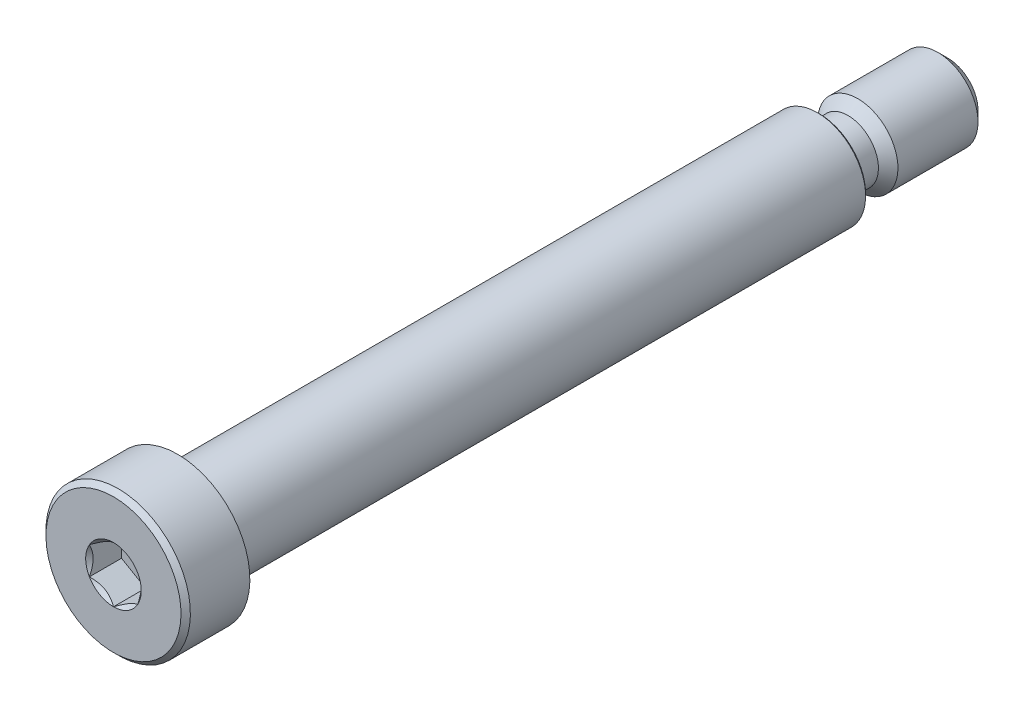
from build123d import *

# Parameters (mm, degrees)
CHAMFER1_SIZE      = 0.993775
CHAMFER2_SIZE      = 0.46434375
CHAMFER3_SIZE      = 0.2032
CUT_EXTRUDE2_DEPTH = 3.175


with BuildPart() as part:
    # Sketch1 → Revolve1 (revolve)
    with BuildSketch(Plane(origin=(0, 0, 0), x_dir=(0, 0, -1), z_dir=(1, 0, 0))):
        Polygon((0, 7.14375), (6.35, 7.14375), (6.35, 4.7625), (69.85, 4.7625), (69.85, 3.9751), (82.55, 3.9751), (82.55, 0), (0, 0), align=None)
    revolve(axis=Axis((0, 0, -82.55), (0, 0, 1)))

    # Sketch5 → Cut-Revolve1 (revolve, cut)
    with BuildSketch(Plane(origin=(0, 0, 0), x_dir=(0, 0, -1), z_dir=(1, 0, 0))):
        with BuildLine():
            Line((69.85, 4.7625), (74.422, 4.7625))
            Line((74.422, 4.7625), (72.6694, 3.0099))
            Line((72.6694, 3.0099), (70.8152, 3.0099))
            ThreePointArc((70.8152, 3.0099), (70.132700535, 3.292600535), (69.85, 3.9751))
            Line((69.85, 3.9751), (69.85, 4.7625))
        make_face()
    revolve(axis=Axis((0, 0, -82.55), (0, 0, 1)), mode=Mode.SUBTRACT)

    # Chamfer1
    chamfer1_edges = [part.edges().sort_by_distance(p)[0] for p in [
        (0, -3.9751, -82.55),
    ]]
    chamfer(chamfer1_edges, length=CHAMFER1_SIZE)

    # Chamfer2
    chamfer2_edges = [part.edges().sort_by_distance(p)[0] for p in [
        (0, -7.14375, 0),
    ]]
    chamfer(chamfer2_edges, length=CHAMFER2_SIZE)

    # Chamfer3
    chamfer3_edges = [part.edges().sort_by_distance(p)[0] for p in [
        (0, -4.7625, -69.85),
    ]]
    chamfer(chamfer3_edges, length=CHAMFER3_SIZE)

    # Sketch8 → Cut-Extrude2 (cut)
    with BuildSketch(Plane.XY):
        Polygon((2.38125, 1.374815329), (0, 2.749630657), (-2.38125, 1.374815329), (-2.38125, -1.374815329), (0, -2.749630657), (2.38125, -1.374815329), align=None)
    extrude(amount=-CUT_EXTRUDE2_DEPTH, mode=Mode.SUBTRACT)

    # Cut-Extrude4 cone 1 section (through the dimple's axis) → Cut-Extrude4 (revolve, cut)
    with BuildSketch(Plane(origin=(0, 0, 0), x_dir=(0, -1, 0), z_dir=(1, 0, 0))):
        Polygon((0, 0), (2.749630657, 0), (0, 2.749630657), align=None)
    revolve(axis=Axis((0, 0, 0), (0, 0, -1)), mode=Mode.SUBTRACT)

    # Sketch12 → Revolve2 (revolve)
    with BuildSketch(Plane(origin=(0, 0, 0), x_dir=(0, 0, -1), z_dir=(1, 0, 0))):
        with BuildLine():
            Line((69.85, 4.5593), (69.6468, 4.7625))
            Line((69.6468, 4.7625), (6.35, 4.7625))
            Line((6.35, 4.7625), (6.35, 0))
            Line((6.35, 0), (69.85, 0))
            Line((69.85, 0), (72.6694, 0))
            Line((72.6694, 0), (72.6694, 3.0099))
            Line((72.6694, 3.0099), (70.8152, 3.0099))
            ThreePointArc((70.8152, 3.0099), (70.132700535, 3.292600535), (69.85, 3.9751))
            Line((69.85, 3.9751), (69.85, 4.5593))
        make_face()
    revolve(axis=Axis((0, 0, -6.35), (0, 0, -1)))


solid = part.part
